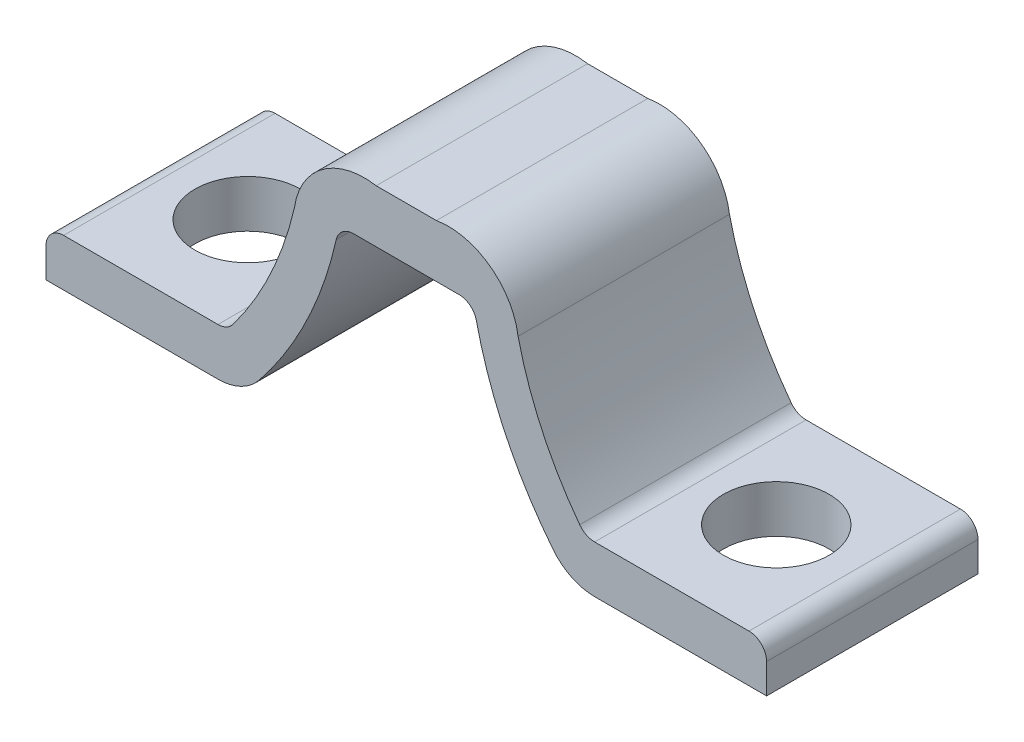
from build123d import *

# Parameters (mm, degrees)
BOSS_EXTRUDE1_DEPTH = 7.62
SKETCH2_R           = 1.905
CUT_EXTRUDE1_DEPTH  = 5.08


with BuildPart() as part:
    # Sketch1 → Boss-Extrude1 (new body)
    with BuildSketch(Plane.XY):
        with BuildLine():
            Line((1.905, 6.985), (-1.905, 6.985))
            ThreePointArc((-1.905, 6.985), (-2.301749521, 6.845797154), (-2.524550498, 6.489219898))
            ThreePointArc((-2.524550498, 6.489219898), (-3.583781011, 3.443081012), (-5.301992306, 0.713853771))
            ThreePointArc((-5.301992306, 0.713853771), (-5.964076777, 0.187711648), (-6.788664987, 0))
            Line((-6.788664987, 0), (-12.985936717, 0))
            Line((-12.985936717, 0), (-12.985936717, 1.073162668))
            ThreePointArc((-12.985936717, 1.073162668), (-12.799949523, 1.522175474), (-12.350936717, 1.708162668))
            Line((-12.350936717, 1.708162668), (-6.788664987, 1.708162668))
            ThreePointArc((-6.788664987, 1.708162668), (-6.488026831, 1.77904797), (-6.250721894, 1.976770993))
            ThreePointArc((-6.250721894, 1.976770993), (-4.890441533, 4.244637177), (-4.029326465, 6.745049248))
            ThreePointArc((-4.029326465, 6.745049248), (-3.010501923, 8.43943232), (-1.085423689, 8.89))
            Line((-1.085423689, 8.89), (1.085423689, 8.89))
            ThreePointArc((1.085423689, 8.89), (3.010501923, 8.43943232), (4.029326465, 6.745049248))
            ThreePointArc((4.029326465, 6.745049248), (4.890441533, 4.244637177), (6.250721894, 1.976770993))
            ThreePointArc((6.250721894, 1.976770993), (6.488026831, 1.77904797), (6.788664987, 1.708162668))
            Line((6.788664987, 1.708162668), (12.350936717, 1.708162668))
            ThreePointArc((12.350936717, 1.708162668), (12.799949523, 1.522175474), (12.985936717, 1.073162668))
            Line((12.985936717, 1.073162668), (12.985936717, 0))
            Line((12.985936717, 0), (6.788664987, 0))
            ThreePointArc((6.788664987, 0), (5.964076777, 0.187711648), (5.301992306, 0.713853771))
            ThreePointArc((5.301992306, 0.713853771), (3.583781011, 3.443081012), (2.524550498, 6.489219898))
            ThreePointArc((2.524550498, 6.489219898), (2.301749521, 6.845797154), (1.905, 6.985))
        make_face()
    extrude(amount=BOSS_EXTRUDE1_DEPTH)

    # Sketch2 → Cut-Extrude1 (cut)
    with BuildSketch(Plane(origin=(0, 1.708162668, 0), x_dir=(1, 0, 0), z_dir=(0, 1, 0))):
        with Locations(Location((9.525, -3.81, 0), (0, 0, 270))):
            Circle(SKETCH2_R)
        with Locations(Location((-9.525, -3.81, 0), (0, 0, 270))):
            Circle(SKETCH2_R)
    extrude(amount=-CUT_EXTRUDE1_DEPTH, mode=Mode.SUBTRACT)


solid = part.part
